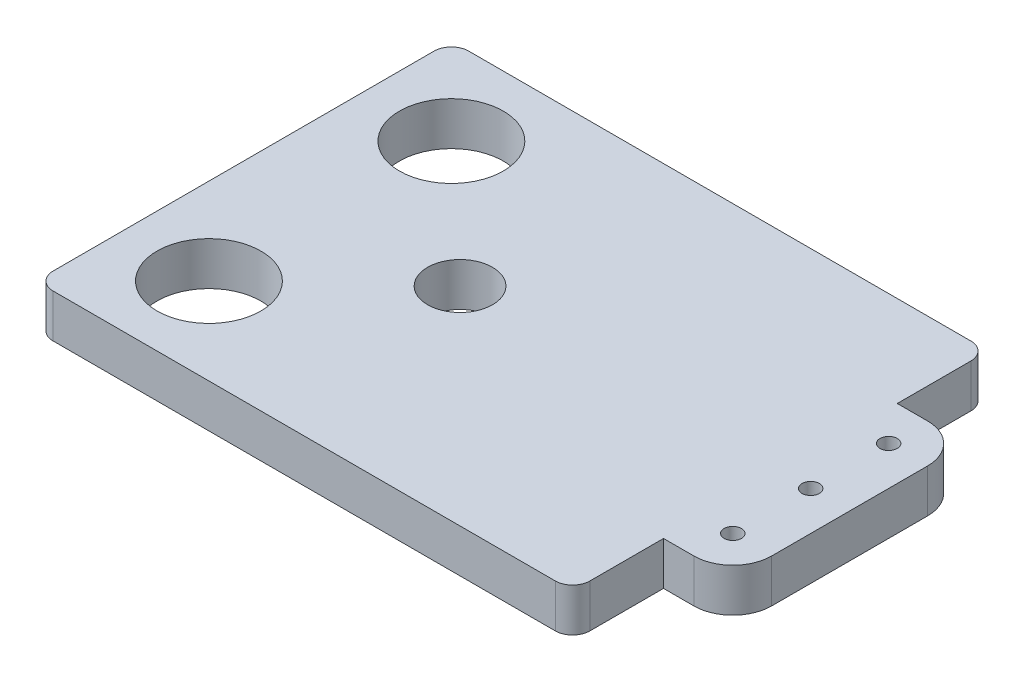
from build123d import *

# Parameters (mm, degrees)
SKETCH1_R           = 6
SKETCH1_R_2         = 3.75
SKETCH1_R_3         = 1
BOSS_EXTRUDE1_DEPTH = 5
FILLET1_R           = 2


with BuildPart() as part:
    # Sketch1 → Boss-Extrude1 (new body)
    with BuildSketch(Plane(origin=(0, 0, 0), x_dir=(1, 0, 0), z_dir=(0, 1, 0))):
        with BuildLine():
            Line((70, 33), (70, 15))
            ThreePointArc((70, 15), (68.681980515, 11.818019485), (65.5, 10.5))
            Line((65.5, 10.5), (62, 10.5))
            Line((62, 10.5), (62, 0))
            Line((62, 0), (0, 0))
            Line((0, 0), (0, 48))
            Line((0, 48), (62, 48))
            Line((62, 48), (62, 37.5))
            Line((62, 37.5), (65.5, 37.5))
            ThreePointArc((65.5, 37.5), (68.681980515, 36.181980515), (70, 33))
        make_face()
        with Locations(Location((10, 10, 0), (0, 0, 270))):
            Circle(SKETCH1_R, mode=Mode.SUBTRACT)
        with Locations(Location((10, 38, 0), (0, 0, 270))):
            Circle(SKETCH1_R, mode=Mode.SUBTRACT)
        with Locations(Location((25, 24, 0), (0, 0, 270))):
            Circle(SKETCH1_R_2, mode=Mode.SUBTRACT)
        with Locations(Location((65.5, 15, 0), (0, 0, 270))):
            Circle(SKETCH1_R_3, mode=Mode.SUBTRACT)
        with Locations(Location((65.5, 24, 0), (0, 0, 270))):
            Circle(SKETCH1_R_3, mode=Mode.SUBTRACT)
        with Locations(Location((65.5, 33, 0), (0, 0, 270))):
            Circle(SKETCH1_R_3, mode=Mode.SUBTRACT)
    extrude(amount=BOSS_EXTRUDE1_DEPTH)

    # Fillet1
    fillet1_edges = [part.edges().sort_by_distance(p)[0] for p in [
        (62, 2.5, 0),
        (0, 2.5, 0),
        (0, 2.5, -48),
        (62, 2.5, -48),
    ]]
    fillet(fillet1_edges, radius=FILLET1_R)


solid = part.part
